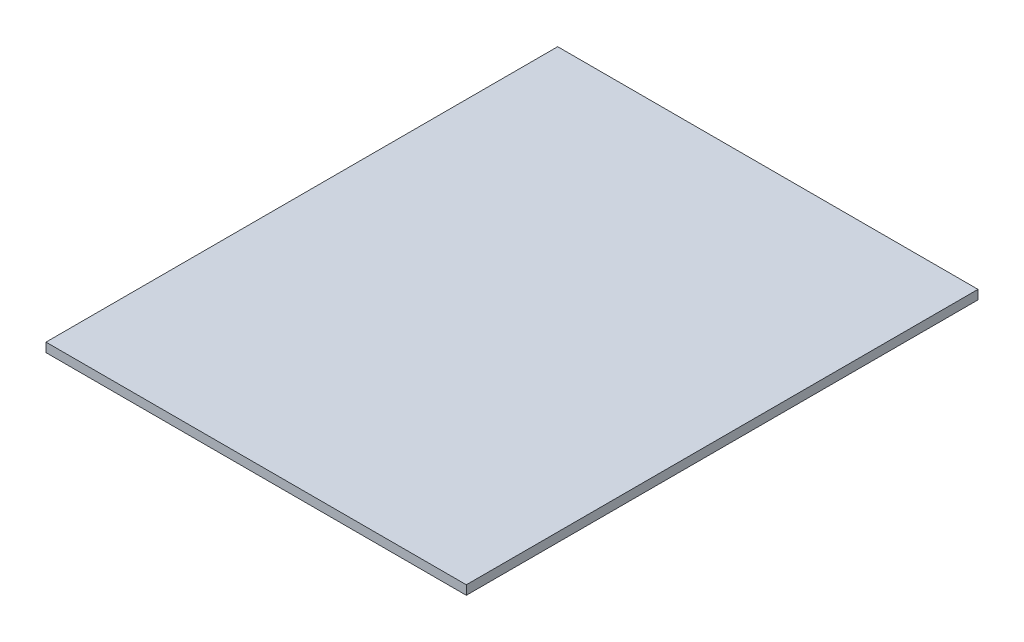
from build123d import *

# Parameters (mm, degrees)
SKETCH2_W           = 230
SKETCH2_H           = 280
BOSS_EXTRUDE1_DEPTH = 5


with BuildPart() as part:
    # Sketch2 → Boss-Extrude1 (new body)
    with BuildSketch(Plane(origin=(0, 0, 0), x_dir=(1, 0, 0), z_dir=(0, 1, 0))):
        with Locations((108.77734532, 138.894100641)):
            Rectangle(SKETCH2_W, SKETCH2_H)
    extrude(amount=BOSS_EXTRUDE1_DEPTH)


solid = part.part
